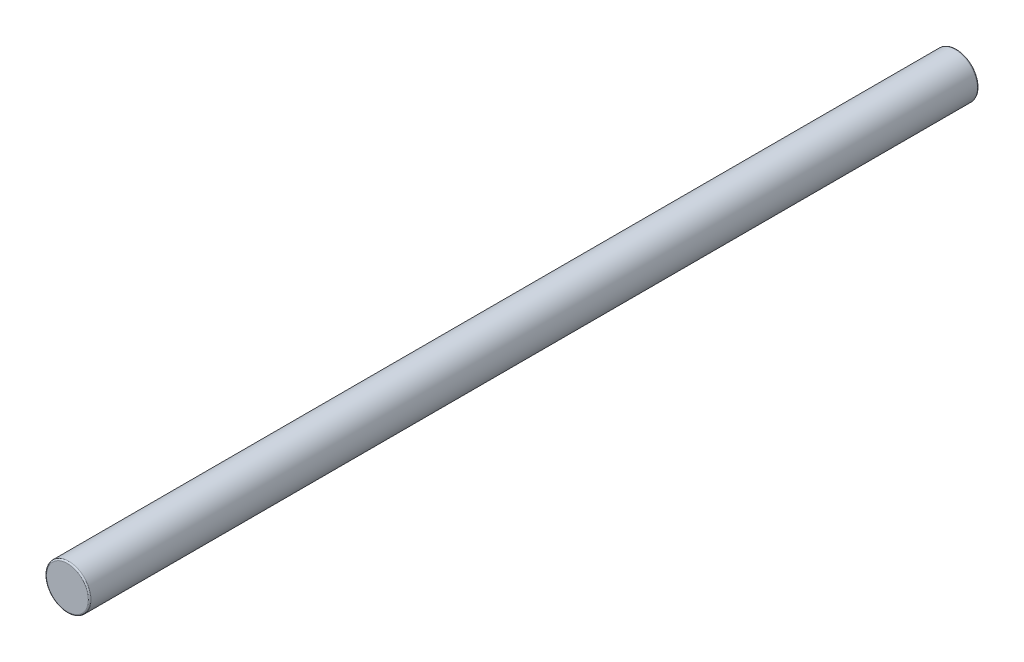
from build123d import *

# Parameters (mm, degrees)
SZKIC1_R                    = 5
DODANIE_WYCI_GNI_CIE1_DEPTH = 100
ZAOKR_GLENIE1_R             = 0.3


with BuildPart() as part:
    # Szkic1 → Dodanie-wyciągnięcie1 (new, symmetric)
    with BuildSketch(Plane.XY):
        Circle(SZKIC1_R)
    extrude(amount=DODANIE_WYCI_GNI_CIE1_DEPTH, both=True)

    # Zaokrąglenie1
    zaokr_glenie1_edges = [part.edges().sort_by_distance(p)[0] for p in [
        (-5, 0, -100),
        (-5, 0, 100),
    ]]
    fillet(zaokr_glenie1_edges, radius=ZAOKR_GLENIE1_R)


solid = part.part
